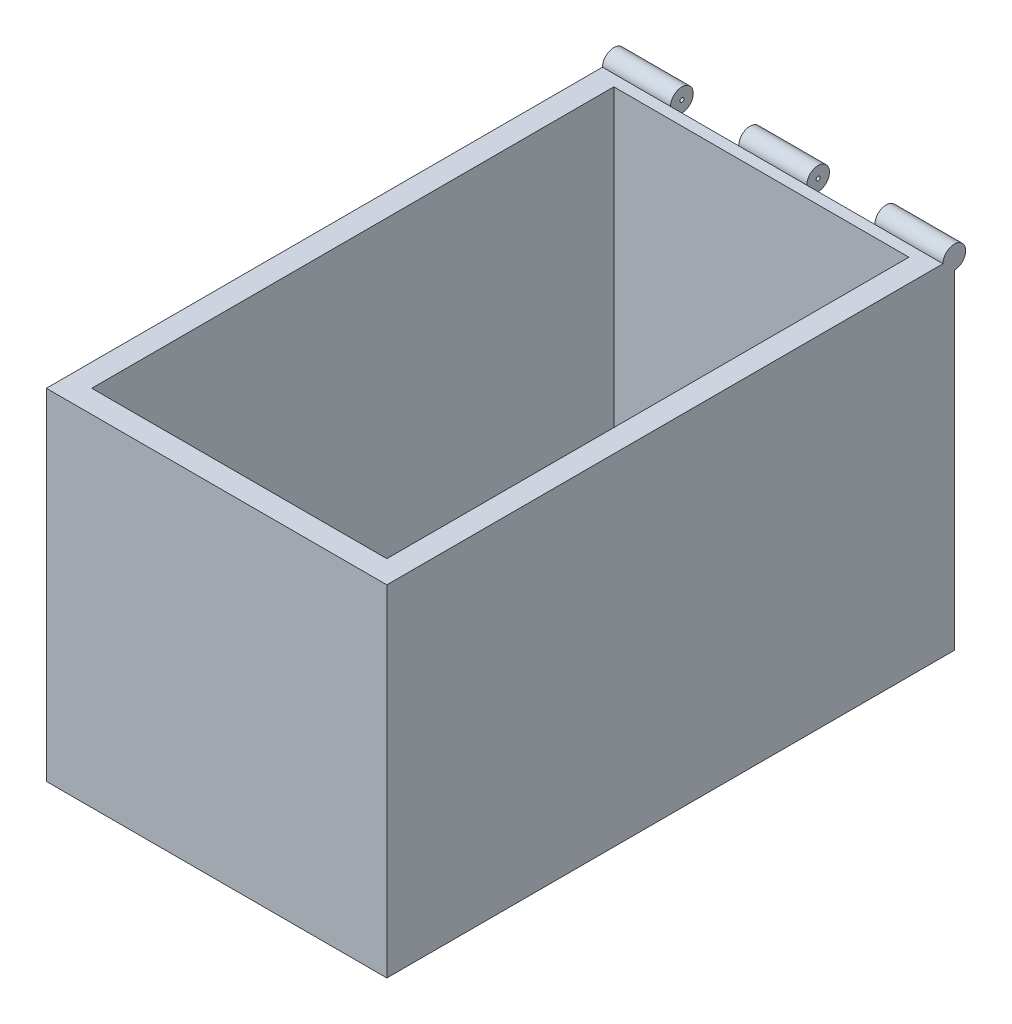
from build123d import *

# Parameters (mm, degrees)
SKETCH1_W           = 150
SKETCH1_H           = 150
BOSS_EXTRUDE1_DEPTH = 250
SHELL1_T            = -10
SKETCH3_W           = 120
SKETCH3_H           = 220
SKETCH3_W_2         = 110
SKETCH3_H_2         = 210
BOSS_EXTRUDE2_DEPTH = 0.001
SKETCH4_W           = 70
SKETCH4_H           = 10
BOSS_EXTRUDE3_DEPTH = 40
SKETCH5_R           = 5
BOSS_EXTRUDE4_DEPTH = 30
SKETCH6_R           = 5
CUT_EXTRUDE2_DEPTH  = 30
SKETCH7_R           = 5
BOSS_EXTRUDE5_DEPTH = 30
SKETCH8_R           = 5
CUT_EXTRUDE3_DEPTH  = 30
SKETCH9_R           = 5
BOSS_EXTRUDE6_DEPTH = 30
SKETCH10_R          = 0.875
CUT_EXTRUDE4_DEPTH  = 145


with BuildPart() as part:
    # Sketch1 → Boss-Extrude1 (new body)
    with BuildSketch(Plane.XY):
        with Locations((75, 75)):
            Rectangle(SKETCH1_W, SKETCH1_H)
    extrude(amount=BOSS_EXTRUDE1_DEPTH)

    # Shell1
    shell1_openings = [part.faces().sort_by_distance(p)[0] for p in [
        (75, 150, 125),
    ]]
    offset(amount=SHELL1_T, openings=shell1_openings, kind=Kind.INTERSECTION)

    # Sketch3 → Boss-Extrude2 (add)
    with BuildSketch(Plane(origin=(0, 0, 0), x_dir=(1, 0, 0), z_dir=(0, 1, 0))):
        with Locations((75, -125)):
            Rectangle(SKETCH3_W, SKETCH3_H)
        with Locations((75, -125)):
            Rectangle(SKETCH3_W_2, SKETCH3_H_2, mode=Mode.SUBTRACT)
    extrude(amount=BOSS_EXTRUDE2_DEPTH)

    # Sketch4 → Boss-Extrude3 (add)
    with BuildSketch(Plane(origin=(0, 0, 0), x_dir=(1, 0, 0), z_dir=(0, 1, 0))):
        with Locations((75, -235)):
            Rectangle(SKETCH4_W, SKETCH4_H)
        with Locations((75, -15)):
            Rectangle(SKETCH4_W, SKETCH4_H)
    extrude(amount=BOSS_EXTRUDE3_DEPTH)

    # Sketch5 → Boss-Extrude4 (add)
    with BuildSketch(Plane.ZY):
        with Locations((0, 150)):
            Circle(SKETCH5_R)
    extrude(amount=-BOSS_EXTRUDE4_DEPTH)

    # Sketch6 → Cut-Extrude2 (cut)
    with BuildSketch(Plane(origin=(30, 0, 0), x_dir=(0, 0, -1), z_dir=(1, 0, 0))):
        with Locations((0, 150)):
            Circle(SKETCH6_R)
    extrude(amount=CUT_EXTRUDE2_DEPTH, mode=Mode.SUBTRACT)

    # Sketch7 → Boss-Extrude5 (add)
    with BuildSketch(Plane.ZY.offset(-60)):
        with Locations((0, 150)):
            Circle(SKETCH7_R)
    extrude(amount=-BOSS_EXTRUDE5_DEPTH)

    # Sketch8 → Cut-Extrude3 (cut)
    with BuildSketch(Plane(origin=(90, 0, 0), x_dir=(0, 0, -1), z_dir=(1, 0, 0))):
        with Locations((0, 150)):
            Circle(SKETCH8_R)
    extrude(amount=CUT_EXTRUDE3_DEPTH, mode=Mode.SUBTRACT)

    # Sketch9 → Boss-Extrude6 (add)
    with BuildSketch(Plane.ZY.offset(-120)):
        with Locations((0, 150)):
            Circle(SKETCH9_R)
    extrude(amount=-BOSS_EXTRUDE6_DEPTH)

    # Sketch10 → Cut-Extrude4 (cut)
    with BuildSketch(Plane.ZY):
        with Locations((0, 150)):
            Circle(SKETCH10_R)
    extrude(amount=-CUT_EXTRUDE4_DEPTH, mode=Mode.SUBTRACT)


solid = part.part
